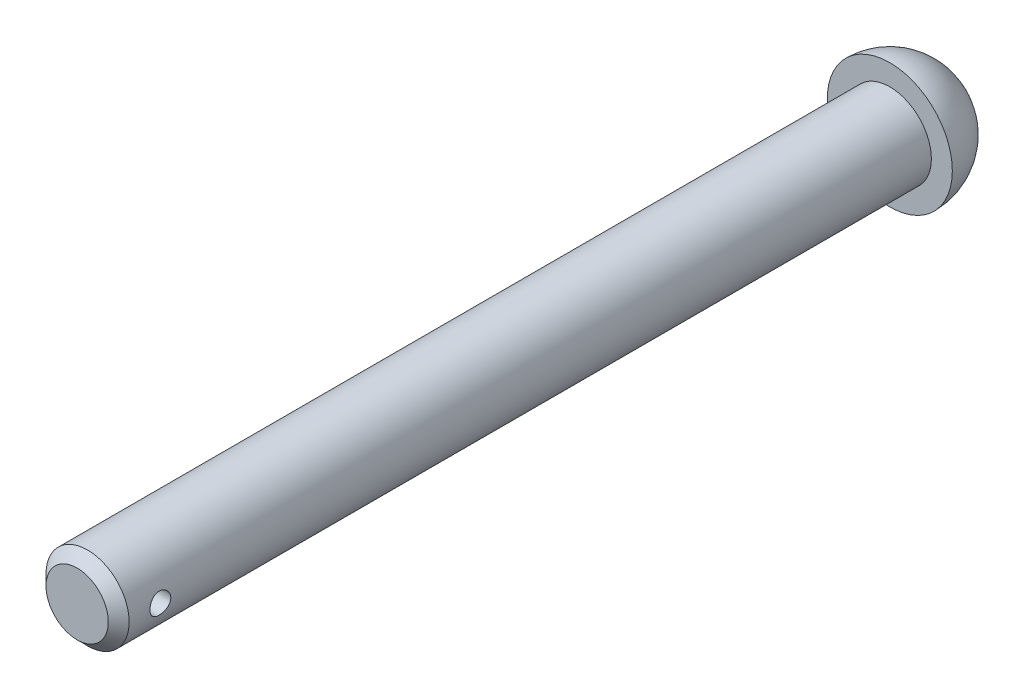
from build123d import *

# Parameters (mm, degrees)
SKETCH2_R          = 0.5
CUT_EXTRUDE1_DEPTH = 5
CHAMFER1_SIZE      = 0.5


with BuildPart() as part:
    # Sketch1 → Revolve1 (revolve)
    with BuildSketch(Plane(origin=(0, 0, 0), x_dir=(0, 0, -1), z_dir=(1, 0, 0)), mode=Mode.PRIVATE) as revolve1_sk:
        with BuildLine():
            Line((0, 1.994594595), (39, 1.994594595))
            Line((39, 1.994594595), (39, 3))
            ThreePointArc((39, 3), (41.121320344, 2.121320344), (42, 0))
            Line((42, 0), (0, 0))
            Line((0, 0), (0, 1.994594595))
        make_face()
    revolve(revolve1_sk.sketch.rotate(Axis((0, 0, 0), (0, 0, -1)), 90), axis=Axis((0, 0, 0), (0, 0, -1)))

    # Sketch2 → Cut-Extrude1 (cut, symmetric)
    with BuildSketch(Plane(origin=(0, 0, 0), x_dir=(0, 0, -1), z_dir=(1, 0, 0))):
        with Locations((2, 0)):
            Circle(SKETCH2_R)
    extrude(amount=CUT_EXTRUDE1_DEPTH, both=True, mode=Mode.SUBTRACT)

    # Chamfer1
    chamfer1_edges = [part.edges().sort_by_distance(p)[0] for p in [
        (-1.994594595, 0, 0),
    ]]
    chamfer(chamfer1_edges, length=CHAMFER1_SIZE)


solid = part.part
